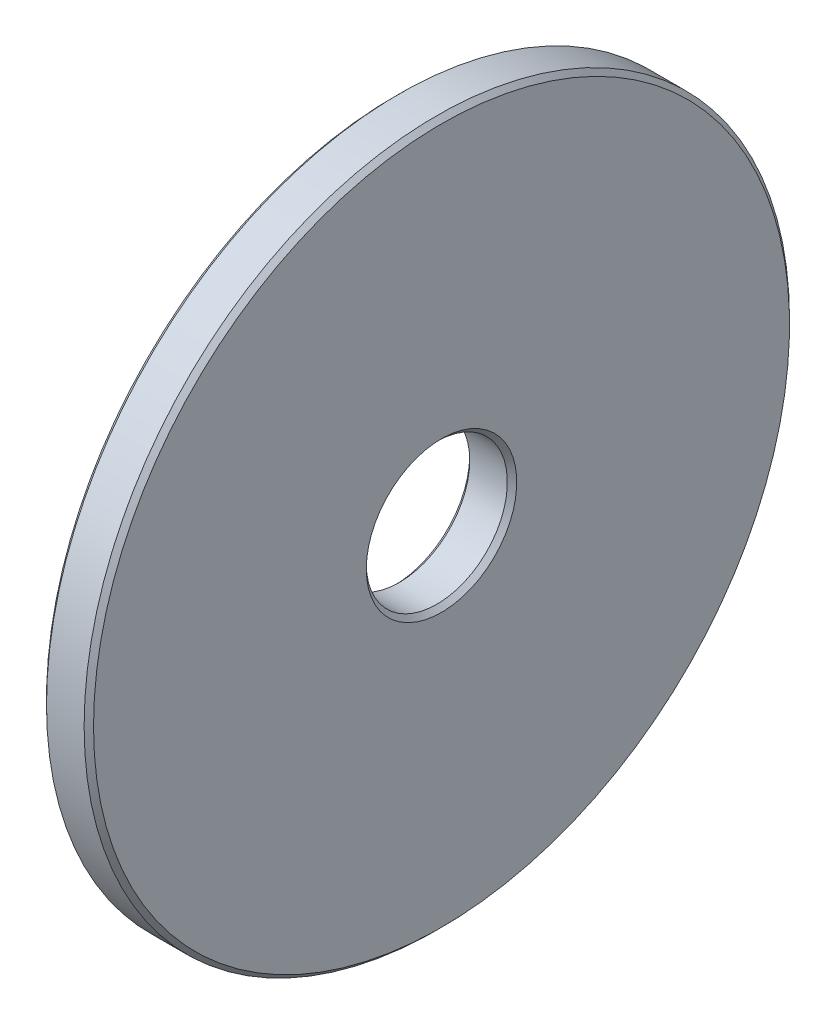
from build123d import *

# Parameters (mm, degrees)
SKETCH_1_W     = 1
SKETCH_1_H     = 6
CHAMFER_1_SIZE = 0.1


with BuildPart() as part:
    # 草图1 → 旋转1 (revolve)
    with BuildSketch(Plane.XY, mode=Mode.PRIVATE) as revolve_1_sk:
        with Locations((-0.5, 4.5)):
            Rectangle(SKETCH_1_W, SKETCH_1_H)
    revolve(revolve_1_sk.sketch.rotate(Axis((-11.624698891, 0, 0), (1, 0, 0)), 90), axis=Axis((-11.624698891, 0, 0), (1, 0, 0)))

    # 倒角1
    chamfer_1_edges = [part.edges().sort_by_distance(p)[0] for p in [
        (-1, 0, -1.5),
        (-1, 0, -7.5),
        (0, 0, -7.5),
        (0, 0, -1.5),
    ]]
    chamfer(chamfer_1_edges, length=CHAMFER_1_SIZE)


solid = part.part
